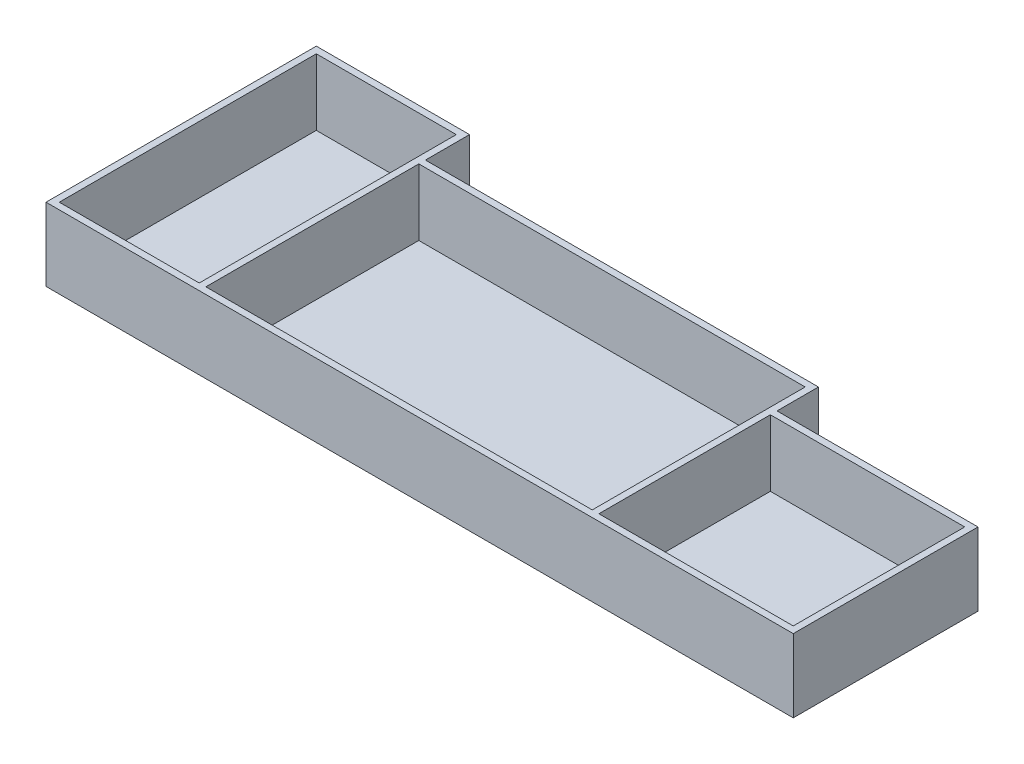
from build123d import *

# Parameters (mm, degrees)
BOSS_EXTRUDE1_DEPTH = 2
SKETCH1_4_W         = 58.6
SKETCH1_4_H         = 51.7
BOSS_EXTRUDE2_DEPTH = 20


with BuildPart() as part:
    # Sketch1 → Boss-Extrude1 (new body)
    with BuildSketch(Plane(origin=(0, 0, 0), x_dir=(1, 0, 0), z_dir=(0, 1, 0))):
        Polygon((0, 0), (223.3, 0), (225.3, 0), (225.3, 55.7), (164.7, 55.7), (164.7, 68.2), (46.2, 68.2), (46.2, 81.5), (0, 81.5), align=None)
    extrude(amount=-BOSS_EXTRUDE1_DEPTH)

    # Sketch1<4> → Boss-Extrude2 (add)
    with BuildSketch(Plane(origin=(0, 0, 0), x_dir=(1, 0, 0), z_dir=(0, 1, 0))):
        Polygon((0, 2), (0, 0), (2, 0), (44.2, 0), (46.2, 0), (162.7, 0), (164.7, 0), (223.3, 0), (225.3, 0), (225.3, 2), (225.3, 55.7), (164.7, 55.7), (164.7, 68.2), (46.2, 68.2), (46.2, 81.5), (2, 81.5), (0, 81.5), (0, 79.5), align=None)
        Polygon((162.7, 2), (46.2, 2), (46.2, 66.2), (162.7, 66.2), (162.7, 55.7), (162.7, 53.7), align=None, mode=Mode.SUBTRACT)
        with Locations((194, 27.85)):
            Rectangle(SKETCH1_4_W, SKETCH1_4_H, mode=Mode.SUBTRACT)
        Polygon((2, 2), (2, 79.5), (44.2, 79.5), (44.2, 68.2), (44.2, 66.2), (44.2, 2), align=None, mode=Mode.SUBTRACT)
    extrude(amount=BOSS_EXTRUDE2_DEPTH)


solid = part.part
